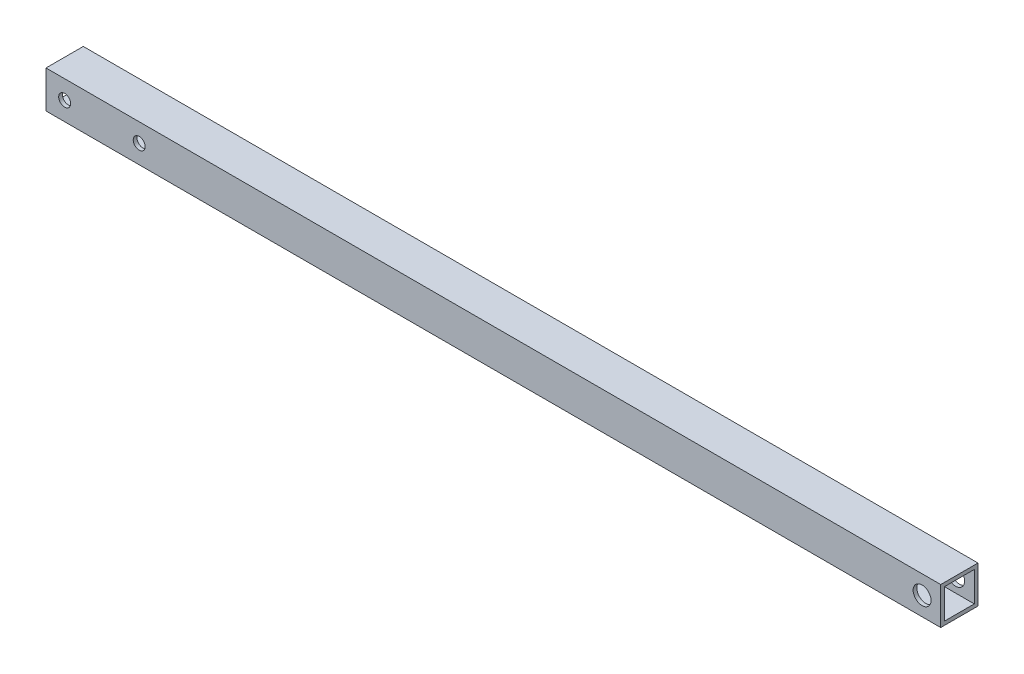
from build123d import *

# Parameters (mm, degrees)
SKETCH_1_W          = 240
SKETCH_1_H          = 10
SKETCH_1_R          = 1.6
SKETCH_1_R_2        = 2.4
EXTRUDE_1_DEPTH     = 10
SKETCH_2_W          = 8
SKETCH_2_H          = 8
CUT_EXTRUDE_1_DEPTH = 347.698716467


with BuildPart() as part:
    # ｽｹｯﾁ1 → ﾎﾞｽ - 押し出し1 (new body)
    with BuildSketch(Plane.XY):
        with Locations((-452.2947342, 245)):
            Rectangle(SKETCH_1_W, SKETCH_1_H)
        with Locations((-567.2947342, 244.999999998)):
            Circle(SKETCH_1_R, mode=Mode.SUBTRACT)
        with Locations((-547.2947342, 244.999999998)):
            Circle(SKETCH_1_R, mode=Mode.SUBTRACT)
        with Locations((-337.2947342, 245)):
            Circle(SKETCH_1_R_2, mode=Mode.SUBTRACT)
    extrude(amount=EXTRUDE_1_DEPTH)

    # ｽｹｯﾁ2 → ｶｯﾄ - 押し出し1 (cut, through all)
    with BuildSketch(Plane.ZY.offset(572.2947342)):
        with Locations((5, 245)):
            Rectangle(SKETCH_2_W, SKETCH_2_H)
    extrude(amount=-CUT_EXTRUDE_1_DEPTH, mode=Mode.SUBTRACT)


solid = part.part
